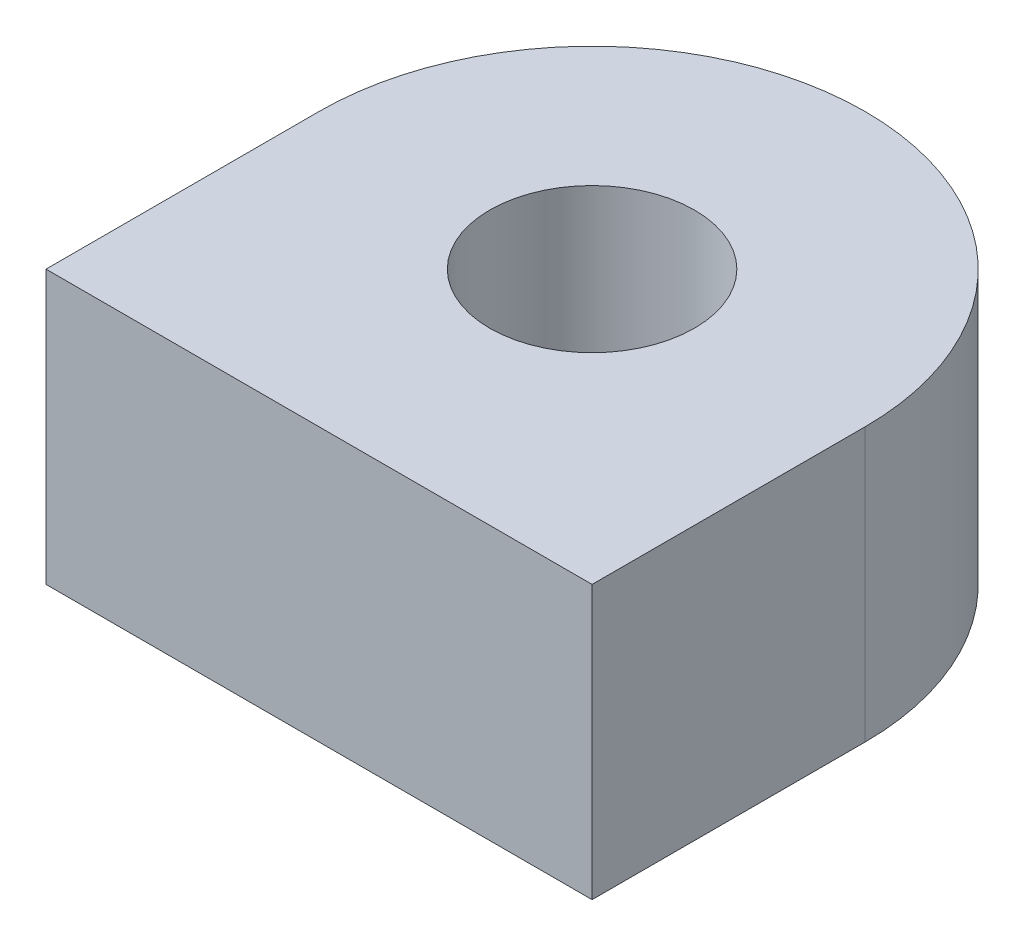
from build123d import *

# Parameters (mm, degrees)
SKETCH1_R           = 9.525
BOSS_EXTRUDE1_DEPTH = 25.4


with BuildPart() as part:
    # Sketch1 → Boss-Extrude1 (new body)
    with BuildSketch(Plane(origin=(0, 0, 0), x_dir=(1, 0, 0), z_dir=(0, 1, 0))):
        with BuildLine():
            Line((-25.4, 0), (-25.4, -25.4))
            Line((-25.4, -25.4), (25.4, -25.4))
            Line((25.4, -25.4), (25.4, 0))
            ThreePointArc((25.4, 0), (0, 25.4), (-25.4, 0))
        make_face()
        with Locations(Location((0, 0, 0), (0, 0, 270))):
            Circle(SKETCH1_R, mode=Mode.SUBTRACT)
    extrude(amount=BOSS_EXTRUDE1_DEPTH)


solid = part.part
